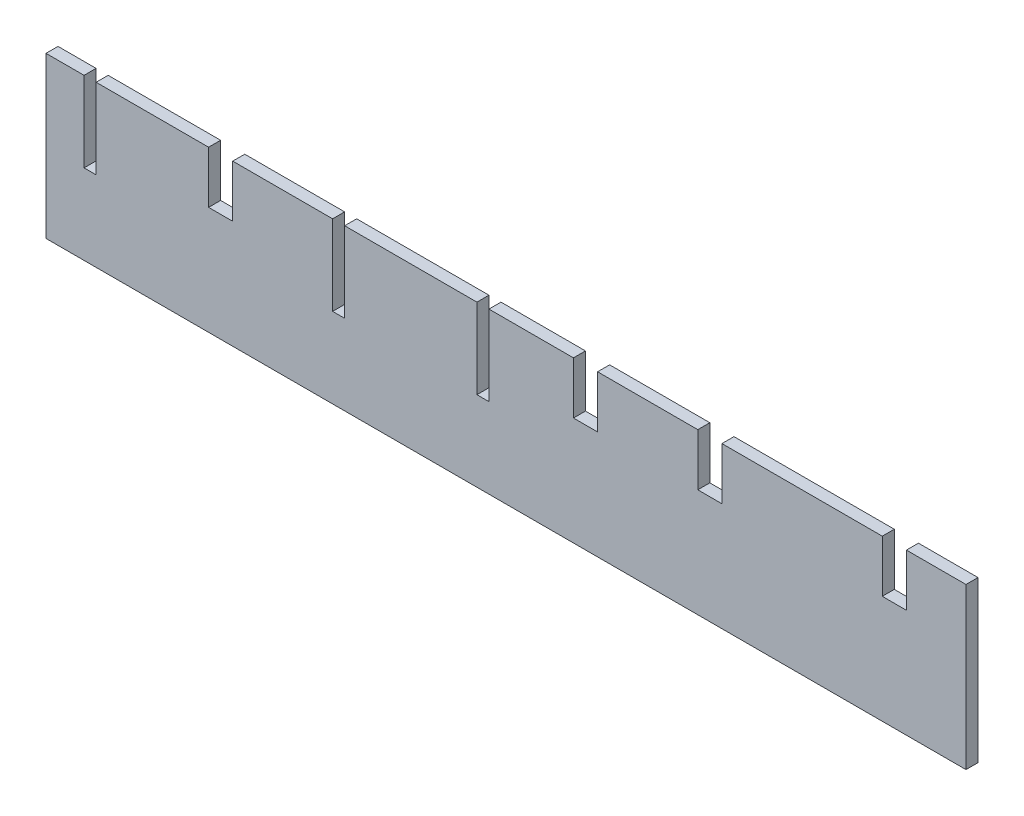
from build123d import *

# Parameters (mm, degrees)
BOSS_EXTRUDE1_DEPTH = 6
SKETCH2_W           = 6
SKETCH2_H           = 40
CUT_EXTRUDE1_DEPTH  = 10


with BuildPart() as part:
    # Sketch1 → Boss-Extrude1 (new body)
    with BuildSketch(Plane.XY):
        Polygon((-79, -40), (380, -40), (380, 40), (350.28, 40), (350.28, 14), (338.24, 14), (338.24, 40), (258.24, 40), (258.24, 14), (246.2, 14), (246.2, 40), (196.2, 40), (196.2, 14), (184.16, 14), (184.16, 40), (14.16, 40), (14.16, 14), (2.12, 14), (2.12, 40), (-79, 40), align=None)
    extrude(amount=BOSS_EXTRUDE1_DEPTH)

    # Sketch2 → Cut-Extrude1 (cut)
    with BuildSketch(Plane(origin=(0, 0, 0), x_dir=(-1, 0, 0), z_dir=(0, 0, -1))):
        with Locations((-67, 20)):
            Rectangle(SKETCH2_W, SKETCH2_H)
        with Locations((57, 20)):
            Rectangle(SKETCH2_W, SKETCH2_H)
        with Locations((-139, 20)):
            Rectangle(SKETCH2_W, SKETCH2_H)
    extrude(amount=-CUT_EXTRUDE1_DEPTH, mode=Mode.SUBTRACT)


solid = part.part
